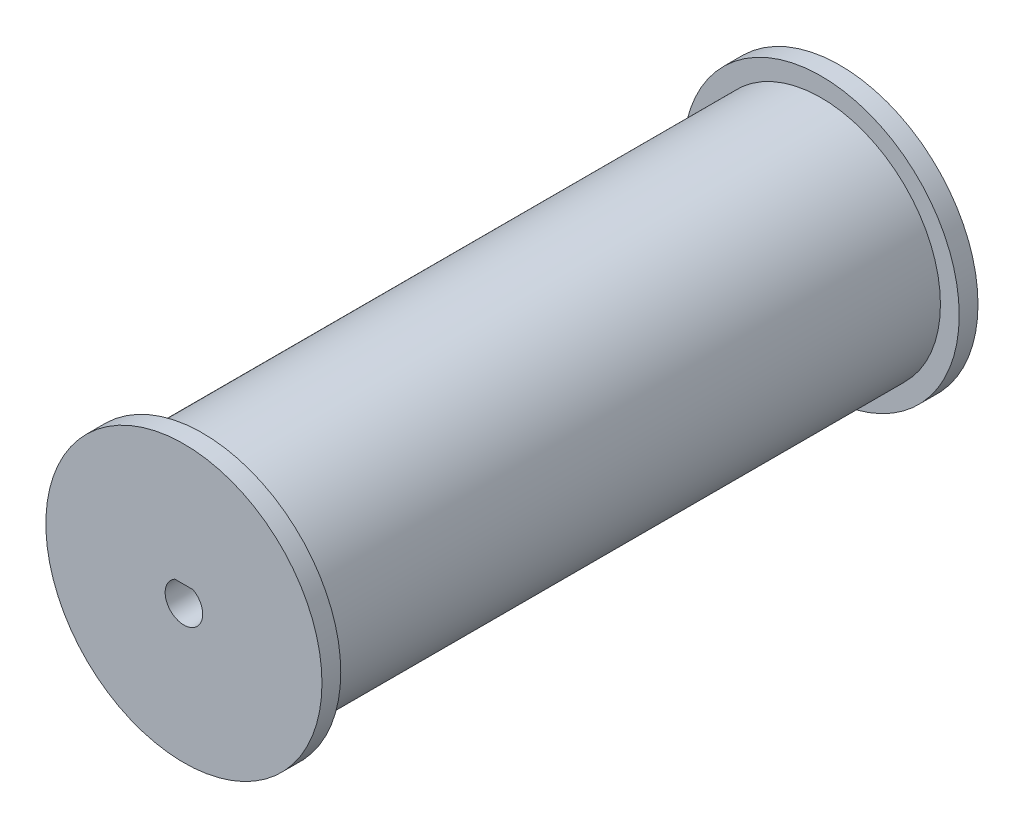
from build123d import *

# Parameters (mm, degrees)
SKETCH1_R           = 12.7
BOSS_EXTRUDE1_DEPTH = 69.85
CUT_EXTRUDE1_DEPTH  = 10
SKETCH3_R           = 3.571999968
CUT_EXTRUDE2_DEPTH  = 34.925
SKETCH5_R           = 14.7
SKETCH5_R_2         = 3.572
BOSS_EXTRUDE2_DEPTH = 2
BOSS_EXTRUDE5_START = 69.85
SKETCH8_R           = 14.7
BOSS_EXTRUDE5_DEPTH = 2


with BuildPart() as part:
    # Sketch1 → Boss-Extrude1 (new body)
    with BuildSketch(Plane.XY):
        Circle(SKETCH1_R)
    extrude(amount=BOSS_EXTRUDE1_DEPTH)

    # Sketch2 → Cut-Extrude1 (cut)
    with BuildSketch(Plane.XY.offset(69.85)):
        with BuildLine():
            Line((-0.968245837, 1.75), (0.968245837, 1.75))
            ThreePointArc((0.968245837, 1.75), (0, -2), (-0.968245837, 1.75))
        make_face()
    extrude(amount=-CUT_EXTRUDE1_DEPTH, mode=Mode.SUBTRACT)

    # Sketch3 → Cut-Extrude2 (cut)
    with BuildSketch(Plane(origin=(0, 0, 0), x_dir=(-1, 0, 0), z_dir=(0, 0, -1))):
        Circle(SKETCH3_R)
    extrude(amount=-CUT_EXTRUDE2_DEPTH, mode=Mode.SUBTRACT)

    # Sketch5 → Boss-Extrude2 (add)
    with BuildSketch(Plane.XY):
        Circle(SKETCH5_R)
        with Locations(Location((0, 0, 0), (0, 0, 180))):
            Circle(SKETCH5_R_2, mode=Mode.SUBTRACT)
    extrude(amount=BOSS_EXTRUDE2_DEPTH)

    # Sketch8 → Boss-Extrude5 (add)
    with BuildSketch(Plane.XY.offset(BOSS_EXTRUDE5_START)):
        Circle(SKETCH8_R)
        with BuildLine():
            Line((-0.968245837, 1.75), (0.968245837, 1.75))
            ThreePointArc((0.968245837, 1.75), (0, -2), (-0.968245837, 1.75))
        make_face(mode=Mode.SUBTRACT)
    extrude(amount=-BOSS_EXTRUDE5_DEPTH)


solid = part.part
